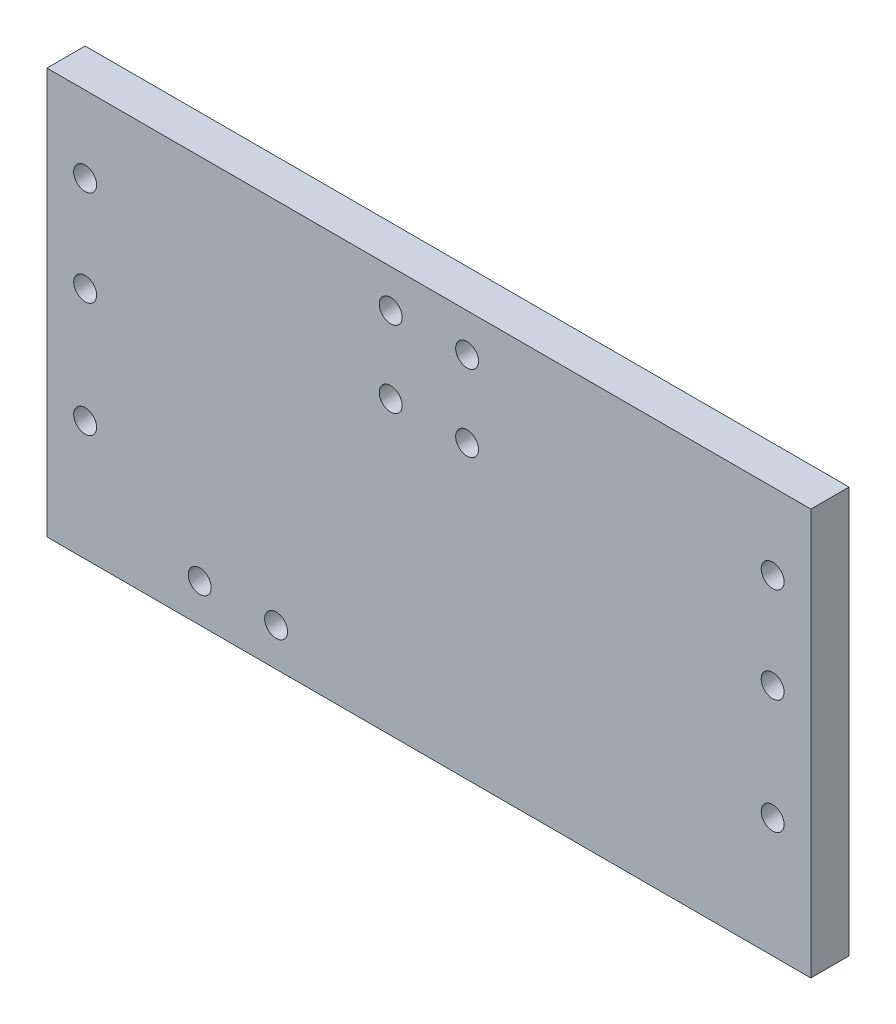
from build123d import *

# Parameters (mm, degrees)
SKETCH1_W           = 100
SKETCH1_H           = 53.16
BOSS_EXTRUDE1_DEPTH = 5
SKETCH2_R           = 1.5
CUT_EXTRUDE1_DEPTH  = 57.846252295


with BuildPart() as part:
    # Sketch1 → Boss-Extrude1 (new body)
    with BuildSketch(Plane.XY):
        Rectangle(SKETCH1_W, SKETCH1_H)
    extrude(amount=BOSS_EXTRUDE1_DEPTH)

    # Sketch2 → Cut-Extrude1 (cut, through all)
    with BuildSketch(Plane.XY.offset(5)):
        with Locations((-45, 16.58)):
            Circle(SKETCH2_R)
        with Locations((-45, 4.08)):
            Circle(SKETCH2_R)
        with Locations((-45, -10.92)):
            Circle(SKETCH2_R)
        with Locations(Location((45, -10.92, 0), (0, 0, 180))):
            Circle(SKETCH2_R)
        with Locations(Location((45, 4.08, 0), (0, 0, 180))):
            Circle(SKETCH2_R)
        with Locations(Location((45, 16.58, 0), (0, 0, 180))):
            Circle(SKETCH2_R)
        with Locations((-5, 11.58)):
            Circle(SKETCH2_R)
        with Locations((-5, 21.58)):
            Circle(SKETCH2_R)
        with Locations(Location((5, 11.58, 0), (0, 0, 180))):
            Circle(SKETCH2_R)
        with Locations(Location((5, 21.58, 0), (0, 0, 180))):
            Circle(SKETCH2_R)
        with Locations((-30, -21.58)):
            Circle(SKETCH2_R)
        with Locations((-20, -21.58)):
            Circle(SKETCH2_R)
    extrude(amount=-CUT_EXTRUDE1_DEPTH, mode=Mode.SUBTRACT)


solid = part.part
